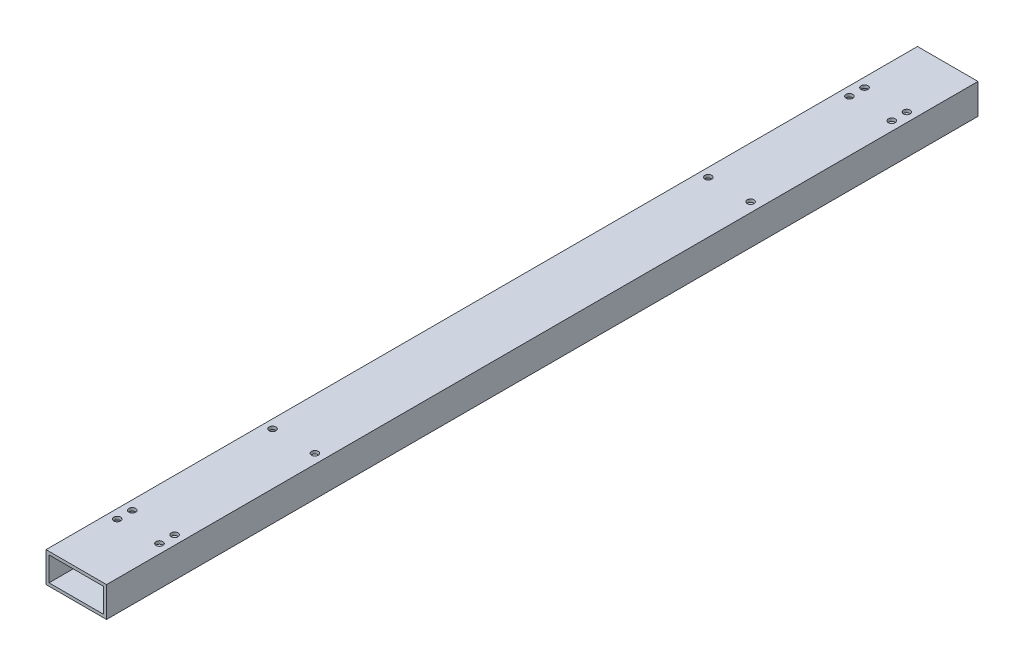
from build123d import *

# Parameters (mm, degrees)
BOSS_EXTRUDE1_DEPTH      = 457.2
BOSS_EXTRUDE1_DEPTH_BACK = 457.2
SKETCH3_W                = 63.5
SKETCH3_H                = 31.75
SKETCH3_W_2              = 57.15
SKETCH3_H_2              = 25.4
SKETCH5_R                = 3.571875
CUT_EXTRUDE1_DEPTH       = 460.399570091
SKETCH8_R                = 3.57251
CUT_EXTRUDE2_DEPTH       = 460.399570091


with BuildPart() as part:
    # Sketch3 → Boss-Extrude1 (new, two sides: drawn at the far end of the back side and taken through both)
    with BuildSketch(Plane.XY.offset(-BOSS_EXTRUDE1_DEPTH_BACK)):
        Rectangle(SKETCH3_W, SKETCH3_H)
        Rectangle(SKETCH3_W_2, SKETCH3_H_2, mode=Mode.SUBTRACT)
    extrude(amount=BOSS_EXTRUDE1_DEPTH + BOSS_EXTRUDE1_DEPTH_BACK)

    # Sketch5 → Cut-Extrude1 (cut, through all)
    with BuildSketch(Plane.XZ.offset(15.875)):
        with Locations(Location((-22.225, 392.1125, 0), (0, 0, 270))):
            Circle(SKETCH5_R)
        with Locations(Location((22.225, 392.1125, 0), (0, 0, 270))):
            Circle(SKETCH5_R)
        with Locations(Location((22.225, -392.1125, 0), (0, 0, 90))):
            Circle(SKETCH5_R)
        with Locations(Location((-22.225, -392.1125, 0), (0, 0, 90))):
            Circle(SKETCH5_R)
        with Locations(Location((22.225, 376.2375, 0), (0, 0, 90))):
            Circle(SKETCH5_R)
        with Locations(Location((-22.225, 376.2375, 0), (0, 0, 90))):
            Circle(SKETCH5_R)
        with Locations(Location((22.225, -376.2375, 0), (0, 0, 270))):
            Circle(SKETCH5_R)
        with Locations(Location((-22.225, -376.2375, 0), (0, 0, 270))):
            Circle(SKETCH5_R)
    extrude(amount=-CUT_EXTRUDE1_DEPTH, mode=Mode.SUBTRACT)

    # Sketch8 → Cut-Extrude2 (cut, through all)
    with BuildSketch(Plane(origin=(0, 15.875, 0), x_dir=(1, 0, 0), z_dir=(0, 1, 0))):
        with Locations(Location((21.772898576, 228.6, 0), (0, 0, 180))):
            Circle(SKETCH8_R)
        with Locations(Location((-22.677101424, 228.6, 0), (0, 0, 180))):
            Circle(SKETCH8_R)
        with Locations(Location((21.772898576, -228.6, 0), (0, 0, 270))):
            Circle(SKETCH8_R)
        with Locations(Location((-22.677101424, -228.6, 0), (0, 0, 270))):
            Circle(SKETCH8_R)
    extrude(amount=-CUT_EXTRUDE2_DEPTH, mode=Mode.SUBTRACT)


solid = part.part
